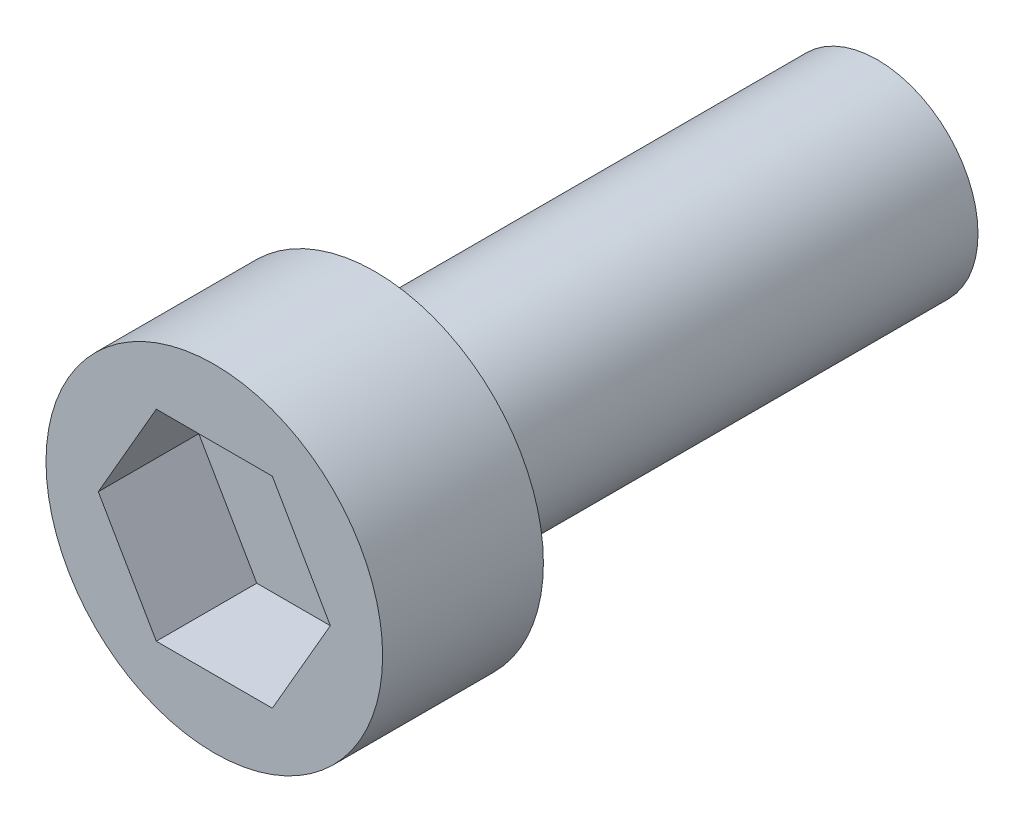
from build123d import *

# Parameters (mm, degrees)
ESQUISSE1_R             = 1
BOSS_EXTRU_1_DEPTH      = 5
ESQUISSE2_R             = 1.675
BOSS_EXTRU_2_DEPTH      = 1.6
ENL_V_MAT_EXTRU_1_DEPTH = 1


with BuildPart() as part:
    # Esquisse1 → Boss.-Extru.1 (new body)
    with BuildSketch(Plane.XY):
        Circle(ESQUISSE1_R)
    extrude(amount=BOSS_EXTRU_1_DEPTH)

    # Esquisse2 → Boss.-Extru.2 (add)
    with BuildSketch(Plane.XY.offset(5)):
        Circle(ESQUISSE2_R)
    extrude(amount=BOSS_EXTRU_2_DEPTH)

    # Esquisse3 → Enlèv. mat.-Extru.1 (cut)
    with BuildSketch(Plane.XY.offset(6.6)):
        Polygon((1.154700538, 0), (0.577350269, 1), (-0.577350269, 1), (-1.154700538, 0), (-0.577350269, -1), (0.577350269, -1), align=None)
    extrude(amount=-ENL_V_MAT_EXTRU_1_DEPTH, mode=Mode.SUBTRACT)


solid = part.part
